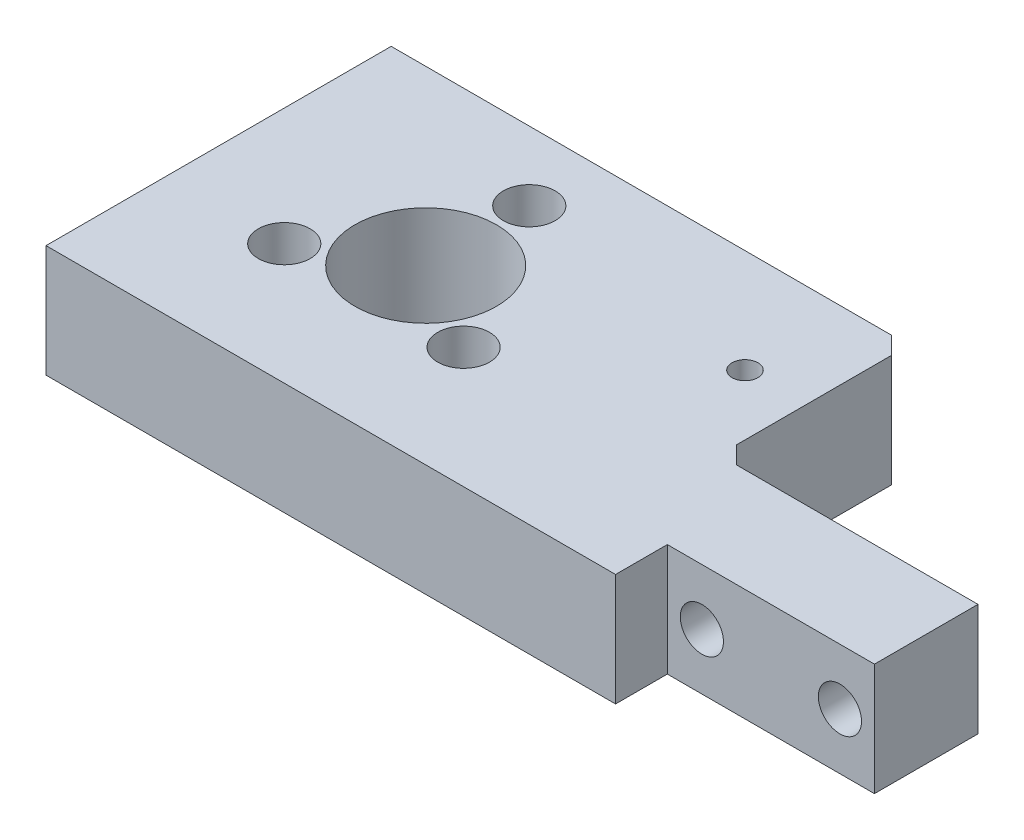
from build123d import *

# Parameters (mm, degrees)
SKETCH_1_W          = 47
SKETCH_1_H          = 20
SKETCH_1_R          = 1.5
SKETCH_1_R_2        = 4.1
EXTRUDE_1_DEPTH     = 6.5
SKETCH_2_W          = 12
SKETCH_2_H          = 3
SKETCH_2_W_2        = 17
SKETCH_2_H_2        = 11
CUT_EXTRUDE_1_DEPTH = 37.976343789
SKETCH_3_R          = 1.25
CUT_EXTRUDE_2_DEPTH = 40.449334595
SKETCH_4_R          = 0.75
CUT_EXTRUDE_3_DEPTH = 37.976343789
CHAMFER_1_SIZE      = 1
SKETCH_5_W          = 2
SKETCH_5_H          = 9
CUT_EXTRUDE_4_DEPTH = 37.976343789


with BuildPart() as part:
    # 草图1 → 凸台-拉伸1 (new body)
    with BuildSketch(Plane(origin=(0, 0, 0), x_dir=(1, 0, 0), z_dir=(0, 1, 0))):
        with Locations((11.5, 0)):
            Rectangle(SKETCH_1_W, SKETCH_1_H)
        with Locations(Location((0, 6, 0), (0, 0, 90))):
            Circle(SKETCH_1_R, mode=Mode.SUBTRACT)
        with Locations(Location((5.196152423, -3, 0), (0, 0, 90))):
            Circle(SKETCH_1_R, mode=Mode.SUBTRACT)
        with Locations(Location((-5.196152423, -3, 0), (0, 0, 90))):
            Circle(SKETCH_1_R, mode=Mode.SUBTRACT)
        with Locations(Location((0, 0, 0), (0, 0, 90))):
            Circle(SKETCH_1_R_2, mode=Mode.SUBTRACT)
    extrude(amount=EXTRUDE_1_DEPTH)

    # 草图2 → 切除-拉伸1 (cut, through all)
    with BuildSketch(Plane(origin=(0, 6.5, 0), x_dir=(1, 0, 0), z_dir=(0, 1, 0))):
        with Locations((27, -8.5)):
            Rectangle(SKETCH_2_W, SKETCH_2_H)
        with Locations((26.5, 4.5)):
            Rectangle(SKETCH_2_W_2, SKETCH_2_H_2)
    extrude(amount=-CUT_EXTRUDE_1_DEPTH, mode=Mode.SUBTRACT)

    # 草图3 → 切除-拉伸2 (cut, through all)
    with BuildSketch(Plane.XY.offset(7)):
        with Locations((23, 3.25)):
            Circle(SKETCH_3_R)
        with Locations((31, 3.25)):
            Circle(SKETCH_3_R)
    extrude(amount=-CUT_EXTRUDE_2_DEPTH, mode=Mode.SUBTRACT)

    # 草图4 → 切除-拉伸3 (cut, through all)
    with BuildSketch(Plane(origin=(0, 6.5, 0), x_dir=(1, 0, 0), z_dir=(0, 1, 0))):
        with Locations(Location((14.5, 3.99875811, 0), (0, 0, 270))):
            Circle(SKETCH_4_R)
    extrude(amount=-CUT_EXTRUDE_3_DEPTH, mode=Mode.SUBTRACT)

    # 倒角1
    chamfer_1_edges = [part.edges().sort_by_distance(p)[0] for p in [
        (18, 3.25, 1),
        (18, 3.25, -10),
    ]]
    chamfer(chamfer_1_edges, length=CHAMFER_1_SIZE)

    # 草图5 → 切除-拉伸4 (cut, through all)
    with BuildSketch(Plane(origin=(0, 6.5, 0), x_dir=(1, 0, 0), z_dir=(0, 1, 0))):
        with Locations((34, -5.5)):
            Rectangle(SKETCH_5_W, SKETCH_5_H)
    extrude(amount=-CUT_EXTRUDE_4_DEPTH, mode=Mode.SUBTRACT)


solid = part.part
